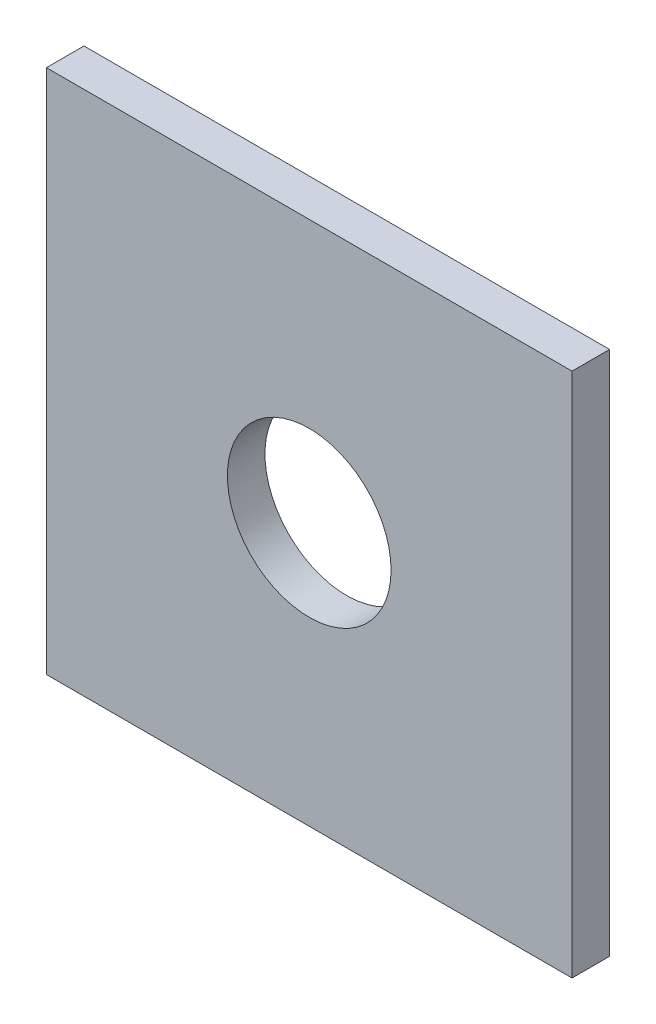
from build123d import *

# Parameters (mm, degrees)
SKETCH_2_W      = 70
SKETCH_2_H      = 70
SKETCH_2_R      = 10.9
EXTRUDE_1_DEPTH = 5


with BuildPart() as part:
    # ｽｹｯﾁ2 → ﾎﾞｽ - 押し出し1 (new body)
    with BuildSketch(Plane.XY):
        with Locations((0, 35)):
            Rectangle(SKETCH_2_W, SKETCH_2_H)
        with Locations((0, 35)):
            Circle(SKETCH_2_R, mode=Mode.SUBTRACT)
    extrude(amount=EXTRUDE_1_DEPTH)


solid = part.part
